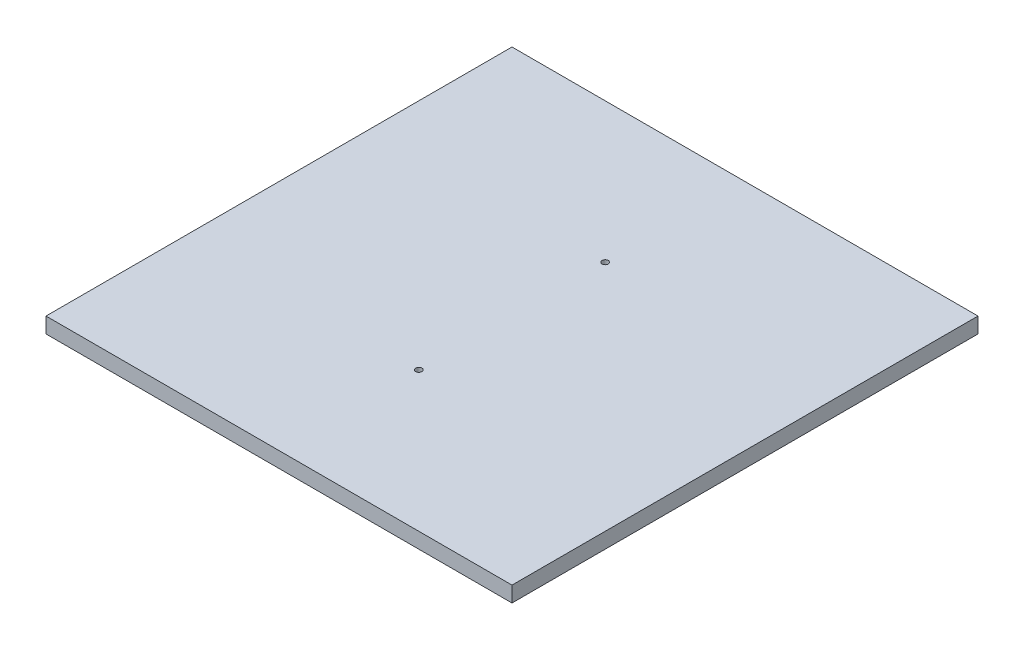
from build123d import *

# Parameters (mm, degrees)
SKETCH1_W           = 150
SKETCH1_H           = 150
SKETCH1_R           = 1
BOSS_EXTRUDE1_DEPTH = 5


with BuildPart() as part:
    # Sketch1 → Boss-Extrude1 (new body)
    with BuildSketch(Plane(origin=(0, 0, 0), x_dir=(1, 0, 0), z_dir=(0, 1, 0))):
        Rectangle(SKETCH1_W, SKETCH1_H)
        with Locations(Location((0, 30, 0), (0, 0, 270))):
            Circle(SKETCH1_R, mode=Mode.SUBTRACT)
        with Locations(Location((0, -30, 0), (0, 0, 270))):
            Circle(SKETCH1_R, mode=Mode.SUBTRACT)
    extrude(amount=BOSS_EXTRUDE1_DEPTH)


solid = part.part
